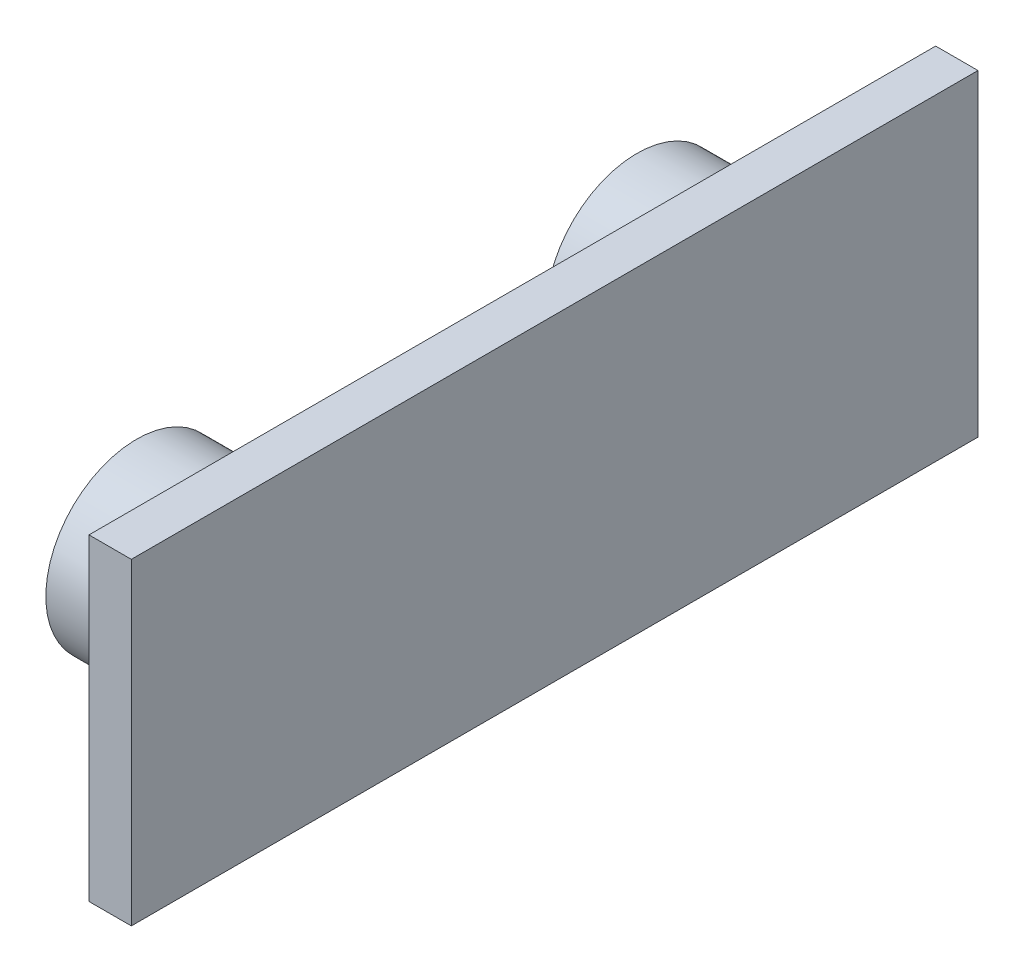
from build123d import *

# Parameters (mm, degrees)
SKETCH1_W           = 40
SKETCH1_H           = 15
SKETCH1_R           = 4.291657496
BOSS_EXTRUDE1_DEPTH = 2
BOSS_EXTRUDE2_START = -8
SKETCH2_R           = 4.291657496
BOSS_EXTRUDE2_DEPTH = 8


with BuildPart() as part:
    # Sketch1 → Boss-Extrude1 (new body)
    with BuildSketch(Plane(origin=(0, 0, 0), x_dir=(0, 0, -1), z_dir=(1, 0, 0))):
        Rectangle(SKETCH1_W, SKETCH1_H)
        with Locations((-11.747572816, 0)):
            Circle(SKETCH1_R, mode=Mode.SUBTRACT)
        with Locations((11.891261172, -0.124269275)):
            Circle(SKETCH1_R, mode=Mode.SUBTRACT)
    extrude(amount=BOSS_EXTRUDE1_DEPTH)

    # Sketch2 → Boss-Extrude2 (add)
    with BuildSketch(Plane(origin=(2, 0, 0), x_dir=(0, 0, -1), z_dir=(1, 0, 0)).offset(BOSS_EXTRUDE2_START)):
        with Locations((-11.747572816, 0)):
            Circle(SKETCH2_R)
        with Locations((11.891261172, -0.124269275)):
            Circle(SKETCH2_R)
    extrude(amount=BOSS_EXTRUDE2_DEPTH)


solid = part.part
